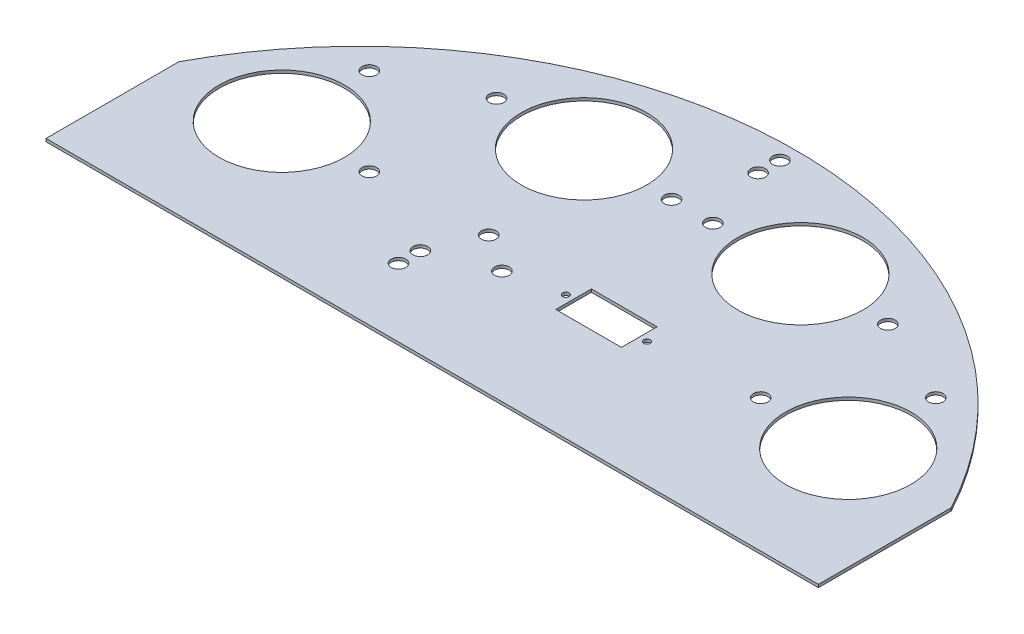
from build123d import *

# Parameters (mm, degrees)
SKETCH3_R             = 21.5
BOSS_EXTRUDE3_DEPTH   = 1
F_5_0MM_DOWEL_HOLE1_D = 5
SKETCH10_R            = 2.5
SKETCH10_R_2          = 1.1
CUT_EXTRUDE3_DEPTH    = 170.731914631


with BuildPart() as part:
    # Sketch3 → Boss-Extrude3 (new body)
    with BuildSketch(Plane(origin=(0, 0, 0), x_dir=(1, 0, 0), z_dir=(0, 1, 0))):
        with BuildLine():
            Line((-132.226234517, -18.972612677), (132.537224892, -18.972612677))
            Line((132.537224892, -18.972612677), (132.537224892, 26.561617598))
            ThreePointArc((132.537224892, 26.561617598), (0.155495187, 106.027387323), (-132.226234517, 26.561617598))
            Line((-132.226234517, 26.561617598), (-132.226234517, -18.972612677))
        make_face()
        with Locations(Location((-96.926544138, 26.561617598, 0), (0, 0, 270))):
            Circle(SKETCH3_R, mode=Mode.SUBTRACT)
        with Locations(Location((97.237534512, 26.561617598, 0), (0, 0, 270))):
            Circle(SKETCH3_R, mode=Mode.SUBTRACT)
        with Locations(Location((-36.926544138, 70.154169278, 0), (0, 0, 270))):
            Circle(SKETCH3_R, mode=Mode.SUBTRACT)
        with Locations(Location((37.237534512, 70.154169278, 0), (0, 0, 270))):
            Circle(SKETCH3_R, mode=Mode.SUBTRACT)
    extrude(amount=BOSS_EXTRUDE3_DEPTH)

    # Ø5.0mm Dowel Hole1 (through all)
    with Locations(Plane(origin=(0, 0, 0), x_dir=(-1, 0, 0), z_dir=(0, -1, 0))):
        with Locations((-97.237534512, 56.561617598), (-67.237534512, 26.561617598), (-67.237534512, 70.154169278), (-7.237534512, 70.154169278), (6.926544138, 70.154169278), (66.926544138, 70.154169278), (96.926544138, 56.561617598), (66.926544138, 26.561617598)):
            Hole(F_5_0MM_DOWEL_HOLE1_D / 2)

    # Sketch10 → Cut-Extrude3 (cut, through all)
    with BuildSketch(Plane(origin=(0, 0, 0), x_dir=(-1, 0, 0), z_dir=(0, -1, 0))):
        Polygon((-28.426423082, 29.82316033), (-28.426423082, 17.62316033), (-16.520871415, 17.62316033), (-5.926423082, 17.62316033), (-5.926423082, 29.82316033), align=None)
        with Locations(Location((27.687865217, 28.254616687, 0), (0, 0, 90))):
            Circle(SKETCH10_R)
        with Locations(Location((14.700079453, 19.79486368, 0), (0, 0, 90))):
            Circle(SKETCH10_R)
        with Locations(Location((34.747097156, 11.87316033, 0), (0, 0, 90))):
            Circle(SKETCH10_R)
        with Locations(Location((34.747097156, 4.37316033, 0), (0, 0, 90))):
            Circle(SKETCH10_R)
        with Locations(Location((-0.03130886, 92.861330123, 0), (0, 0, 90))):
            Circle(SKETCH10_R)
        with Locations(Location((-0.026423082, 100.361328532, 0), (0, 0, 90))):
            Circle(SKETCH10_R)
        with Locations(Location((-31.076423082, 23.72316033, 0), (0, 0, 90))):
            Circle(SKETCH10_R_2)
        with Locations(Location((-3.276423082, 23.72316033, 0), (0, 0, 90))):
            Circle(SKETCH10_R_2)
    extrude(amount=-CUT_EXTRUDE3_DEPTH, mode=Mode.SUBTRACT)


solid = part.part
